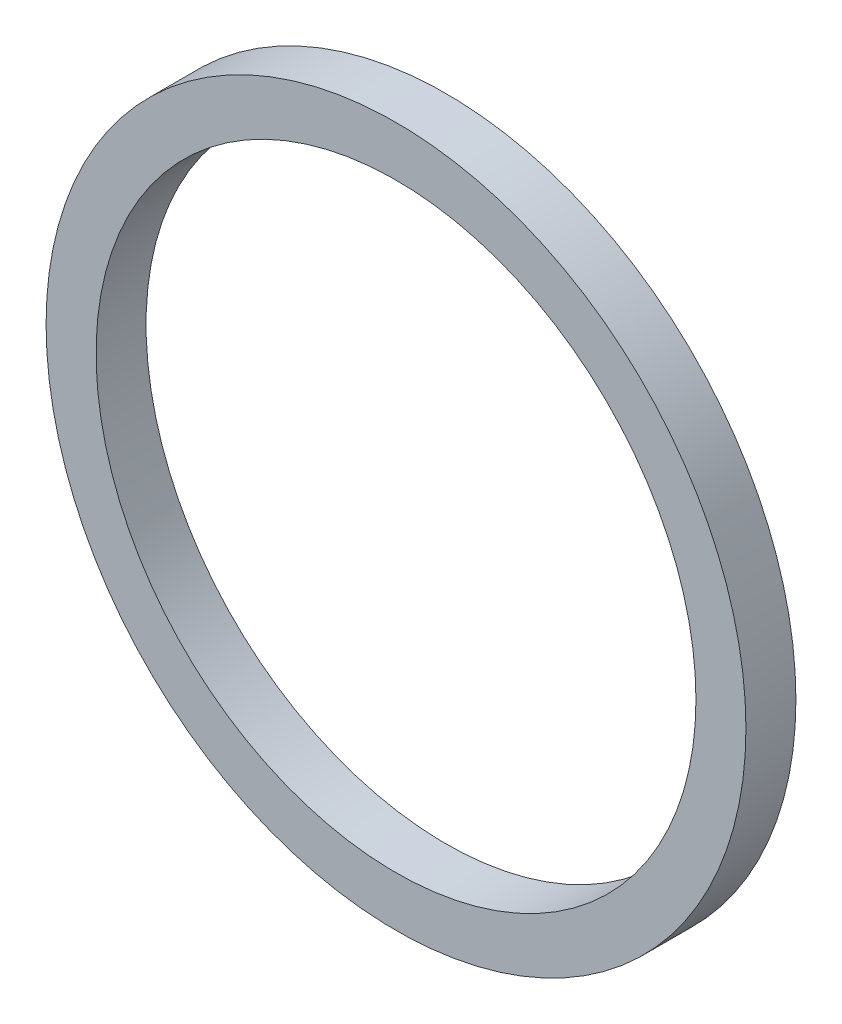
from build123d import *

# Parameters (mm, degrees)
SKETCH_1_R      = 7
SKETCH_1_R_2    = 6
EXTRUDE_1_DEPTH = 1


with BuildPart() as part:
    # 草图1 → 凸台-拉伸1 (new body)
    with BuildSketch(Plane.XY):
        Circle(SKETCH_1_R)
        Circle(SKETCH_1_R_2, mode=Mode.SUBTRACT)
    extrude(amount=EXTRUDE_1_DEPTH)


solid = part.part
